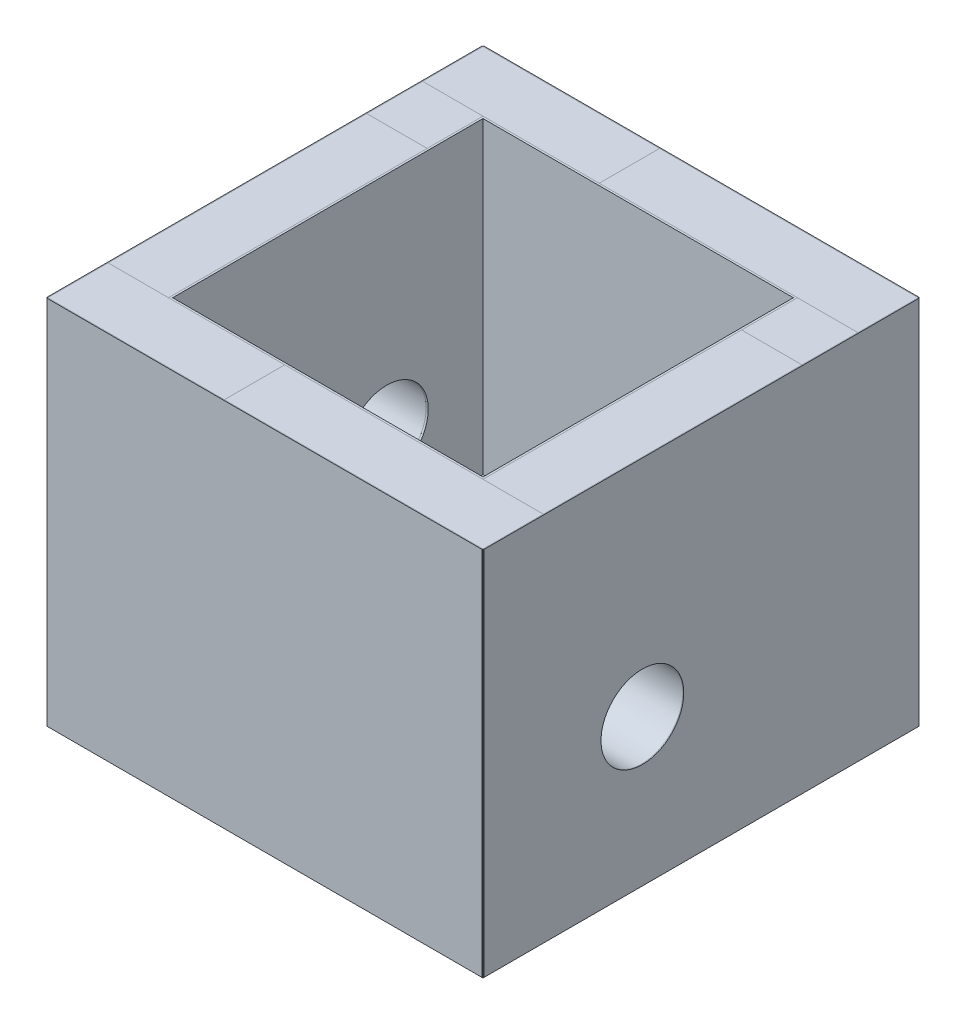
from build123d import *

# Parameters (mm, degrees)
SKETCH1_W            = 457.2
SKETCH1_H            = 457.2
BOSS_EXTRUDE1_DEPTH  = 3.048
SKETCH2_W            = 457.2
SKETCH2_H            = 457.2
BOSS_EXTRUDE2_DEPTH  = 3.048
SKETCH3_W            = 460.248
SKETCH3_H            = 457.2
BOSS_EXTRUDE3_DEPTH  = 3.048
SKETCH4_W            = 457.2
SKETCH4_H            = 454.152
BOSS_EXTRUDE4_DEPTH  = 3.048
SKETCH5_W            = 457.2
SKETCH5_H            = 454.152
BOSS_EXTRUDE5_DEPTH  = 3.048
BOSS_EXTRUDE6_DEPTH  = 88.9
SKETCH6_3_W          = 82.296
SKETCH6_3_H          = 76.2
BOSS_EXTRUDE7_DEPTH  = 88.9
SKETCH6_4_W          = 82.296
SKETCH6_4_H          = 381
BOSS_EXTRUDE8_DEPTH  = 88.9
SKETCH7_W            = 88.9
SKETCH7_H            = 381
BOSS_EXTRUDE9_DEPTH  = 88.9
SKETCH7_3_W          = 260.096
SKETCH7_3_H          = 381
BOSS_EXTRUDE10_DEPTH = 88.9
SKETCH7_4_W          = 260.096
SKETCH7_4_H          = 76.2
BOSS_EXTRUDE11_DEPTH = 88.9
BOSS_EXTRUDE12_DEPTH = 88.9
SKETCH8_3_W          = 171.196
SKETCH8_3_H          = 292.1
BOSS_EXTRUDE13_DEPTH = 88.9
SKETCH8_4_W          = 171.196
SKETCH8_4_H          = 171.196
BOSS_EXTRUDE14_DEPTH = 88.9
SKETCH9_W            = 641.096
SKETCH9_H            = 546.1
BOSS_EXTRUDE15_DEPTH = 1.2192
SKETCH10_W           = 641.096
SKETCH10_H           = 546.1
BOSS_EXTRUDE16_DEPTH = 1.2192
SKETCH11_W           = 641.096
SKETCH11_H           = 641.096
BOSS_EXTRUDE17_DEPTH = 1.2192
CUT_EXTRUDE1_START   = -93.1672
SKETCH12_R           = 60.96
CUT_EXTRUDE1_DEPTH   = 93.1672
CIRPATTERN1_COUNT    = 2


with BuildPart() as part:
    # Sketch1 → Boss-Extrude1 (new body)
    with BuildSketch(Plane(origin=(0, 0, 0), x_dir=(1, 0, 0), z_dir=(0, 1, 0))):
        with Locations((228.6, 228.6)):
            Rectangle(SKETCH1_W, SKETCH1_H)
    extrude(amount=BOSS_EXTRUDE1_DEPTH)

    # Sketch2 → Boss-Extrude2 (add)
    with BuildSketch(Plane.ZY):
        with Locations((-228.6, 228.6)):
            Rectangle(SKETCH2_W, SKETCH2_H)
    extrude(amount=BOSS_EXTRUDE2_DEPTH)

    # Sketch3 → Boss-Extrude3 (add)
    with BuildSketch(Plane.XY):
        with Locations((227.076, 228.6)):
            Rectangle(SKETCH3_W, SKETCH3_H)
    extrude(amount=BOSS_EXTRUDE3_DEPTH)

    # Sketch4 → Boss-Extrude4 (add)
    with BuildSketch(Plane(origin=(457.2, 0, 0), x_dir=(0, 0, -1), z_dir=(1, 0, 0))):
        Polygon((-3.048, 457.2), (-3.048, 0), (457.2, 0), (457.2, 3.048), (0, 3.048), (0, 457.2), align=None)
        with Locations((228.6, 230.124)):
            Rectangle(SKETCH4_W, SKETCH4_H)
    extrude(amount=BOSS_EXTRUDE4_DEPTH)

    # Sketch5 → Boss-Extrude5 (add)
    with BuildSketch(Plane(origin=(0, 0, -457.2), x_dir=(-1, 0, 0), z_dir=(0, 0, -1))):
        with Locations((-228.6, 230.124)):
            Rectangle(SKETCH5_W, SKETCH5_H)
        Polygon((-460.248, 457.2), (-460.248, 0), (3.048, 0), (3.048, 457.2), (0, 457.2), (0, 3.048), (-457.2, 3.048), (-457.2, 457.2), align=None)
    extrude(amount=BOSS_EXTRUDE5_DEPTH)


with BuildPart() as body_2:
    # Sketch6 → Boss-Extrude6 (new body)
    with BuildSketch(Plane(origin=(460.248, 0, 0), x_dir=(0, 0, -1), z_dir=(1, 0, 0))):
        Polygon((377.952, 457.2), (-3.048, 457.2), (-3.048, 0), (377.952, 0), (377.952, 381), align=None)
    extrude(amount=BOSS_EXTRUDE6_DEPTH)


with BuildPart() as body_3:
    # Sketch6<3> → Boss-Extrude7 (new body)
    with BuildSketch(Plane(origin=(460.248, 0, 0), x_dir=(0, 0, -1), z_dir=(1, 0, 0))):
        with Locations((419.1, 419.1)):
            Rectangle(SKETCH6_3_W, SKETCH6_3_H)
    extrude(amount=BOSS_EXTRUDE7_DEPTH)


with BuildPart() as body_4:
    # Sketch6<4> → Boss-Extrude8 (new body)
    with BuildSketch(Plane(origin=(460.248, 0, 0), x_dir=(0, 0, -1), z_dir=(1, 0, 0))):
        with Locations((419.1, 190.5)):
            Rectangle(SKETCH6_4_W, SKETCH6_4_H)
    extrude(amount=BOSS_EXTRUDE8_DEPTH)


with BuildPart() as body_5:
    # Mirror1: mirrored copy
    add(body_3.part.mirror(Plane(origin=(228.6, 0, 0), x_dir=(0, 0, 1), z_dir=(1, 0, 0))))


with BuildPart() as body_6:
    # Mirror1 2: mirrored copy
    add(body_2.part.mirror(Plane(origin=(228.6, 0, 0), x_dir=(0, 0, 1), z_dir=(1, 0, 0))))


with BuildPart() as body_7:
    # Mirror1 3: mirrored copy
    add(body_4.part.mirror(Plane(origin=(228.6, 0, 0), x_dir=(0, 0, 1), z_dir=(1, 0, 0))))


with BuildPart() as body_8:
    # Sketch7 → Boss-Extrude9 (new body)
    with BuildSketch(Plane(origin=(0, 0, -460.248), x_dir=(-1, 0, 0), z_dir=(0, 0, -1))):
        Polygon((-168.148, 457.2), (-549.148, 457.2), (-549.148, 381), (-460.248, 381), (-460.248, 0), (-168.148, 0), (-168.148, 76.2), align=None)
        with Locations((-504.698, 190.5)):
            Rectangle(SKETCH7_W, SKETCH7_H)
    extrude(amount=BOSS_EXTRUDE9_DEPTH)


with BuildPart() as body_9:
    # Sketch7<3> → Boss-Extrude10 (new body)
    with BuildSketch(Plane(origin=(0, 0, -460.248), x_dir=(-1, 0, 0), z_dir=(0, 0, -1))):
        with Locations((-38.1, 266.7)):
            Rectangle(SKETCH7_3_W, SKETCH7_3_H)
    extrude(amount=BOSS_EXTRUDE10_DEPTH)


with BuildPart() as body_10:
    # Sketch7<4> → Boss-Extrude11 (new body)
    with BuildSketch(Plane(origin=(0, 0, -460.248), x_dir=(-1, 0, 0), z_dir=(0, 0, -1))):
        with Locations((-38.1, 38.1)):
            Rectangle(SKETCH7_4_W, SKETCH7_4_H)
    extrude(amount=BOSS_EXTRUDE11_DEPTH)


with BuildPart() as body_11:
    # Mirror2: mirrored copy
    add(body_9.part.mirror(Plane(origin=(0, 0, -228.6), x_dir=(1, 0, 0), z_dir=(0, 0, -1))))


with BuildPart() as body_12:
    # Mirror2 2: mirrored copy
    add(body_8.part.mirror(Plane(origin=(0, 0, -228.6), x_dir=(1, 0, 0), z_dir=(0, 0, -1))))


with BuildPart() as body_13:
    # Mirror2 3: mirrored copy
    add(body_10.part.mirror(Plane(origin=(0, 0, -228.6), x_dir=(1, 0, 0), z_dir=(0, 0, -1))))


with BuildPart() as body_14:
    # Sketch8 → Boss-Extrude12 (new body)
    with BuildSketch(Plane.XZ):
        Polygon((289.052, -289.052), (289.052, 3.048), (-3.048, 3.048), (-3.048, -460.248), (289.052, -460.248), align=None)
        Polygon((289.052, 91.948), (-91.948, 91.948), (-91.948, -549.148), (289.052, -549.148), (289.052, -460.248), (-3.048, -460.248), (-3.048, 3.048), (289.052, 3.048), align=None)
    extrude(amount=BOSS_EXTRUDE12_DEPTH)


with BuildPart() as body_15:
    # Sketch8<3> → Boss-Extrude13 (new body)
    with BuildSketch(Plane.XZ):
        with Locations((374.65, -143.002)):
            Rectangle(SKETCH8_3_W, SKETCH8_3_H)
        Polygon((549.148, 91.948), (289.052, 91.948), (289.052, 3.048), (460.248, 3.048), (460.248, -289.052), (549.148, -289.052), align=None)
    extrude(amount=BOSS_EXTRUDE13_DEPTH)


with BuildPart() as body_16:
    # Sketch8<4> → Boss-Extrude14 (new body)
    with BuildSketch(Plane.XZ):
        with Locations((374.65, -374.65)):
            Rectangle(SKETCH8_4_W, SKETCH8_4_H)
        Polygon((289.052, -460.248), (289.052, -549.148), (549.148, -549.148), (549.148, -289.052), (460.248, -289.052), (460.248, -460.248), align=None)
    extrude(amount=BOSS_EXTRUDE14_DEPTH)


with BuildPart() as body_17:
    # Sketch9 → Boss-Extrude15 (new body)
    with BuildSketch(Plane(origin=(549.148, 0, 0), x_dir=(0, 0, -1), z_dir=(1, 0, 0))):
        with Locations((228.6, 184.15)):
            Rectangle(SKETCH9_W, SKETCH9_H)
    extrude(amount=BOSS_EXTRUDE15_DEPTH)


with BuildPart() as body_18:
    # Sketch10 → Boss-Extrude16 (new body)
    with BuildSketch(Plane(origin=(0, 0, -549.148), x_dir=(-1, 0, 0), z_dir=(0, 0, -1))):
        with Locations((-228.6, 184.15)):
            Rectangle(SKETCH10_W, SKETCH10_H)
    extrude(amount=BOSS_EXTRUDE16_DEPTH)


with BuildPart() as body_19:
    # Mirror3: mirrored copy
    add(body_17.part.mirror(Plane(origin=(228.6, 0, 0), x_dir=(0, 0, 1), z_dir=(1, 0, 0))))


with BuildPart() as body_20:
    # Mirror4: mirrored copy
    add(body_18.part.mirror(Plane(origin=(0, 0, -228.6), x_dir=(1, 0, 0), z_dir=(0, 0, -1))))


with BuildPart() as body_21:
    # Sketch11 → Boss-Extrude17 (new body)
    with BuildSketch(Plane.XZ.offset(88.9)):
        with Locations((228.6, -228.6)):
            Rectangle(SKETCH11_W, SKETCH11_H)
    extrude(amount=BOSS_EXTRUDE17_DEPTH)


with BuildPart() as cut_extrude1_tool:
    # Sketch12 → Cut-Extrude1 (new body)
    with BuildSketch(Plane.ZY.offset(93.1672).offset(CUT_EXTRUDE1_START)):
        with Locations((-315.593802346, 127)):
            Circle(SKETCH12_R)
    cut_extrude1 = extrude(amount=CUT_EXTRUDE1_DEPTH)


with BuildPart() as part_1:
    add(part.part)

    # Cut-Extrude1: cut by cut_extrude1_tool
    add(cut_extrude1_tool.part, mode=Mode.SUBTRACT)


with BuildPart() as body_6_1:
    add(body_6.part)

    # Cut-Extrude1: cut by cut_extrude1_tool
    add(cut_extrude1_tool.part, mode=Mode.SUBTRACT)


with BuildPart() as body_19_1:
    add(body_19.part)

    # Cut-Extrude1: cut by cut_extrude1_tool
    add(cut_extrude1_tool.part, mode=Mode.SUBTRACT)


with BuildPart() as cirpattern1_tool:
    # CirPattern1: Cut-Extrude1 ×2 about axis
    cirpattern1_axis = Axis((228.6, 479.9076, -228.6), (0, -1, 0))
    for i in range(1, CIRPATTERN1_COUNT):
        add(cut_extrude1.rotate(cirpattern1_axis, i * 360 / CIRPATTERN1_COUNT))


with BuildPart() as part_2:
    add(part_1.part)

    # CirPattern1: cut by cirpattern1_tool
    add(cirpattern1_tool.part, mode=Mode.SUBTRACT)


with BuildPart() as body_2_1:
    add(body_2.part)

    # CirPattern1: cut by cirpattern1_tool
    add(cirpattern1_tool.part, mode=Mode.SUBTRACT)


with BuildPart() as body_17_1:
    add(body_17.part)

    # CirPattern1: cut by cirpattern1_tool
    add(cirpattern1_tool.part, mode=Mode.SUBTRACT)


solid = Compound([body_3.part, body_4.part, body_5.part, body_7.part, body_8.part, body_9.part, body_10.part, body_11.part, body_12.part, body_13.part, body_14.part, body_15.part, body_16.part, body_18.part, body_20.part, body_21.part, body_6_1.part, body_19_1.part, part_2.part, body_2_1.part, body_17_1.part])
